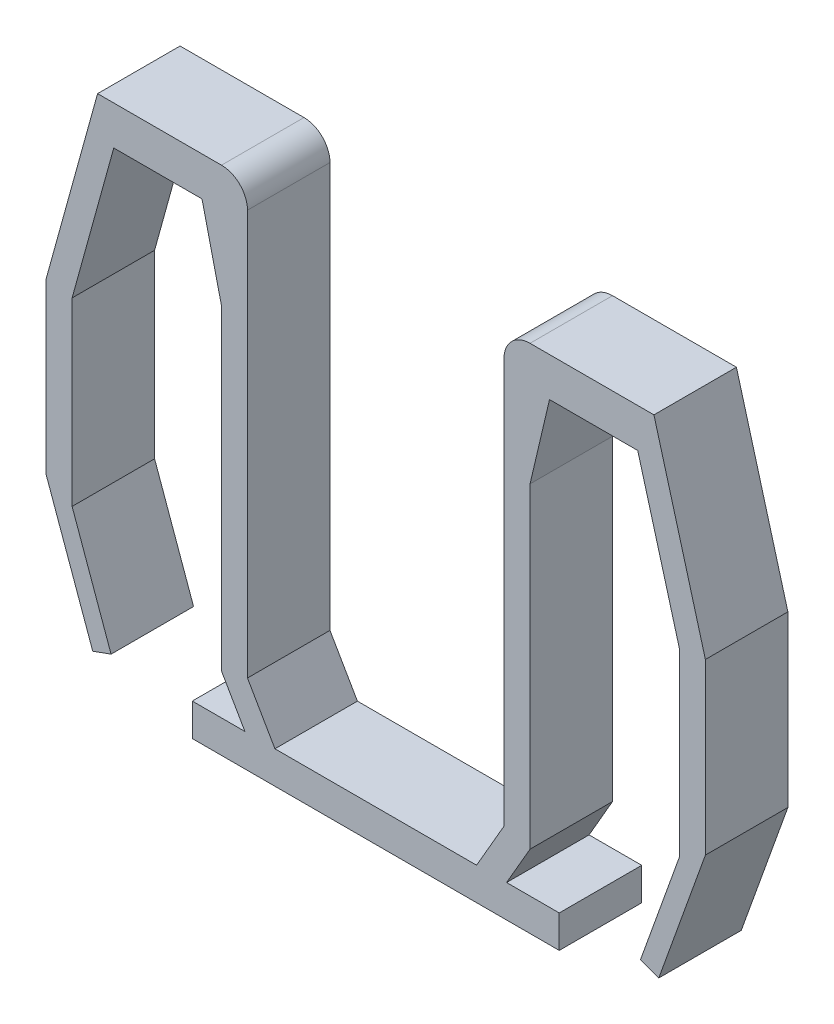
from build123d import *

# Parameters (mm, degrees)
BOSS_EXTRUDE1_DEPTH = 25.4
FILLET1_R           = 8


with BuildPart() as part:
    # Sketch1 → Boss-Extrude1 (new body)
    with BuildSketch(Plane.XY):
        Polygon((7, -61.2), (-5, -27.8), (-5, 27.8), (7.829493088, 74.2), (35, 74.2), (41, 48.7), (41, -48.7), (48.216878365, -61.2), (32, -61.2), (32, -71.2), (145, -71.2), (145, -61.2), (128.783121635, -61.2), (136, -48.7), (136, 48.7), (142, 74.2), (169.170506912, 74.2), (182, 27.8), (182, -27.8), (170, -61.2), (175.646616425, -63.228724464), (190, -23.278473513), (190, 28.88562364), (174.152706997, 86.2), (128, 86.2), (128, -46.556406461), (119.545517328, -61.2), (57.454482672, -61.2), (49, -46.556406461), (49, 86.2), (2.847293003, 86.2), (-13, 28.88562364), (-13, -23.278473513), (1.353383575, -63.228724464), align=None)
    extrude(amount=-BOSS_EXTRUDE1_DEPTH)

    # Fillet1
    fillet1_edges = [part.edges().sort_by_distance(p)[0] for p in [
        (49, 86.2, -12.7),
        (128, 86.2, -12.7),
    ]]
    fillet(fillet1_edges, radius=FILLET1_R)


solid = part.part
